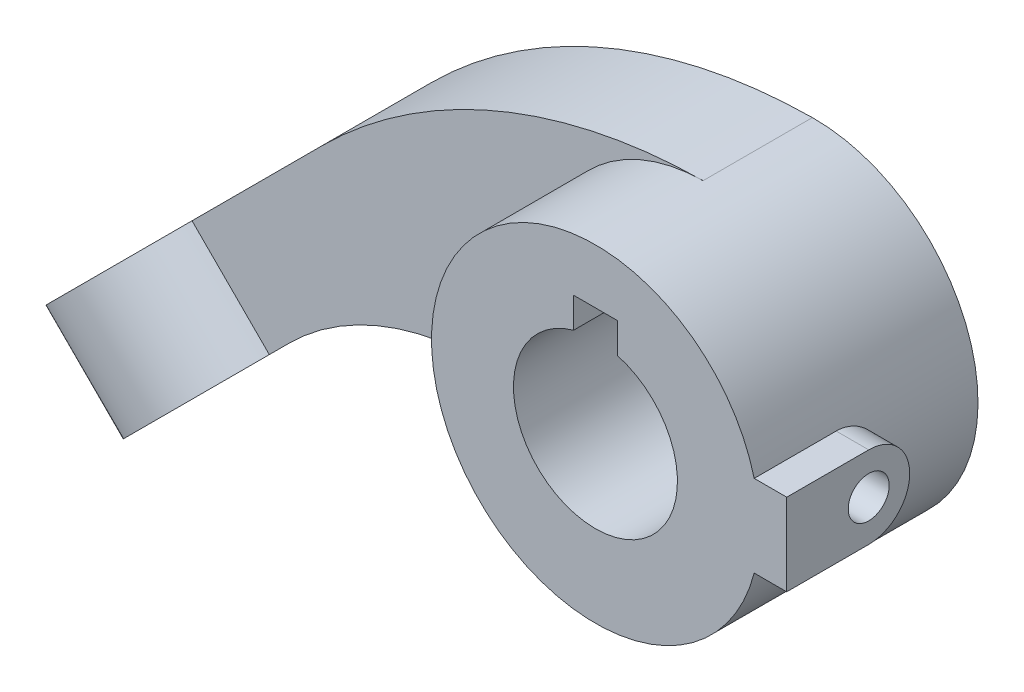
from build123d import *

# Parameters (mm, degrees)
EXTRUDE_1_DEPTH     = 40
EXTRUDE_2_DEPTH     = 20
SKETCH_2_R          = 20
SKETCH_2_R_2        = 10
EXTRUDE_3_DEPTH     = 20
CUT_EXTRUDE_1_DEPTH = 20
EXTRUDE_4_REACH     = 174.452
SKETCH_3_R          = 3.75
CUT_EXTRUDE_2_REACH = 174.452
SKETCH_3_2_R        = 3.75


with BuildPart() as part:
    # 草图1 → 凸台-拉伸1 (new body)
    with BuildSketch(Plane.XY):
        with BuildLine():
            ThreePointArc((30, 0), (21.104689625, 21.321164974), (-0.306138389, 29.998437947))
            ThreePointArc((-0.306138389, 29.998437947), (-28.981985351, 7.748840242), (-15.236295048, -25.842896765))
            ThreePointArc((-15.236295048, -25.842896765), (14.88138348, -26.048885307), (30, 0))
        make_face()
        with BuildLine():
            Line((-4, 14.456832295), (-4, 20))
            Line((-4, 20), (4, 20))
            Line((4, 20), (4, 14.456832295))
            ThreePointArc((4, 14.456832295), (0, -15), (-4, 14.456832295))
        make_face(mode=Mode.SUBTRACT)
    extrude(amount=EXTRUDE_1_DEPTH)

    # 草图1<3> → 凸台-拉伸2 (add)
    with BuildSketch(Plane.XY):
        with BuildLine():
            Line((-69.996355211, 0.714322908), (-106.066017178, -35.355339059))
            Line((-106.066017178, -35.355339059), (-91.923881554, -49.497474683))
            Line((-91.923881554, -49.497474683), (-75.985459186, -33.559052315))
            ThreePointArc((-75.985459186, -33.559052315), (-46.930334751, -19.312906561), (-15.236295048, -25.842896765))
            ThreePointArc((-15.236295048, -25.842896765), (-28.981985351, 7.748840242), (-0.306138389, 29.998437947))
            ThreePointArc((-0.306138389, 29.998437947), (-38.024919972, 22.195136051), (-69.996355211, 0.714322908))
        make_face()
    extrude(amount=EXTRUDE_2_DEPTH)

    # 草图2 → 凸台-拉伸3 (add)
    with BuildSketch(Plane(origin=(-21.213203436, 21.213203436, 0), x_dir=(0, 0, -1), z_dir=(0.7071067811865452, -0.7071067811865498, 0))):
        with Locations((-10, -100)):
            Circle(SKETCH_2_R)
        with Locations((-10, -100)):
            Circle(SKETCH_2_R_2, mode=Mode.SUBTRACT)
    extrude(amount=-EXTRUDE_3_DEPTH)

    # 草图2<3> → 切除-拉伸1 (cut)
    with BuildSketch(Plane(origin=(-21.213203436, 21.213203436, 0), x_dir=(0, 0, -1), z_dir=(0.7071067811865452, -0.7071067811865498, 0))):
        with BuildLine():
            Line((-20, -100), (0, -100))
            ThreePointArc((0, -100), (-10, -90), (-20, -100))
        make_face()
    extrude(amount=-CUT_EXTRUDE_1_DEPTH, mode=Mode.SUBTRACT)

    # 草图3 → 凸台-拉伸4 (add, up to next)
    with BuildSketch(Plane(origin=(35, 0, 0), x_dir=(0, 0, -1), z_dir=(1, 0, 0)), mode=Mode.PRIVATE) as extrude_4_sk1:
        with BuildLine():
            Line((-25, 7.5), (-40, 7.5))
            Line((-40, 7.5), (-40, -7.5))
            Line((-40, -7.5), (-25, -7.5))
            ThreePointArc((-25, -7.5), (-17.5, 0), (-25, 7.5))
        make_face()
        with Locations((-25, 0)):
            Circle(SKETCH_3_R, mode=Mode.SUBTRACT)
    extrude_4_tool1 = extrude(extrude_4_sk1.sketch, amount=-EXTRUDE_4_REACH, mode=Mode.PRIVATE) - part.part
    add(extrude_4_tool1.solids().sort_by_distance((35, 0, 30.224226))[0])

    # 草图3<2> → 切除-拉伸2 (cut, up to next)
    with BuildSketch(Plane(origin=(35, 0, 0), x_dir=(0, 0, -1), z_dir=(1, 0, 0)), mode=Mode.PRIVATE) as cut_extrude_2_sk1:
        with Locations((-25, 0)):
            Circle(SKETCH_3_2_R)
    cut_extrude_2_tool1 = extrude(cut_extrude_2_sk1.sketch, amount=-CUT_EXTRUDE_2_REACH, mode=Mode.PRIVATE) & part.part
    add(cut_extrude_2_tool1.solids().sort_by_distance((35, 0, 25))[0], mode=Mode.SUBTRACT)


solid = part.part
